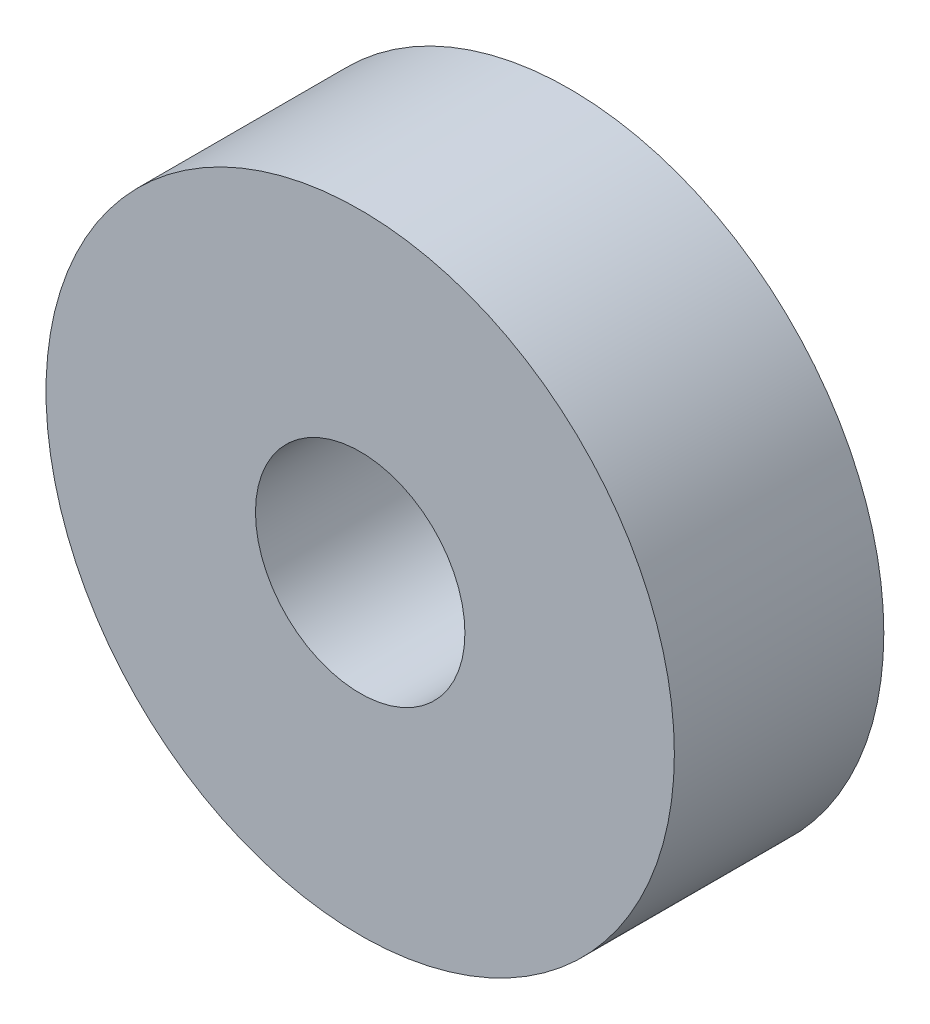
from build123d import *

# Parameters (mm, degrees)
SKETCH1_R           = 1.5
SKETCH1_R_2         = 0.5
BOSS_EXTRUDE1_DEPTH = 1


with BuildPart() as part:
    # Sketch1 → Boss-Extrude1 (new body)
    with BuildSketch(Plane.XY):
        Circle(SKETCH1_R)
        Circle(SKETCH1_R_2, mode=Mode.SUBTRACT)
    extrude(amount=BOSS_EXTRUDE1_DEPTH)


solid = part.part
